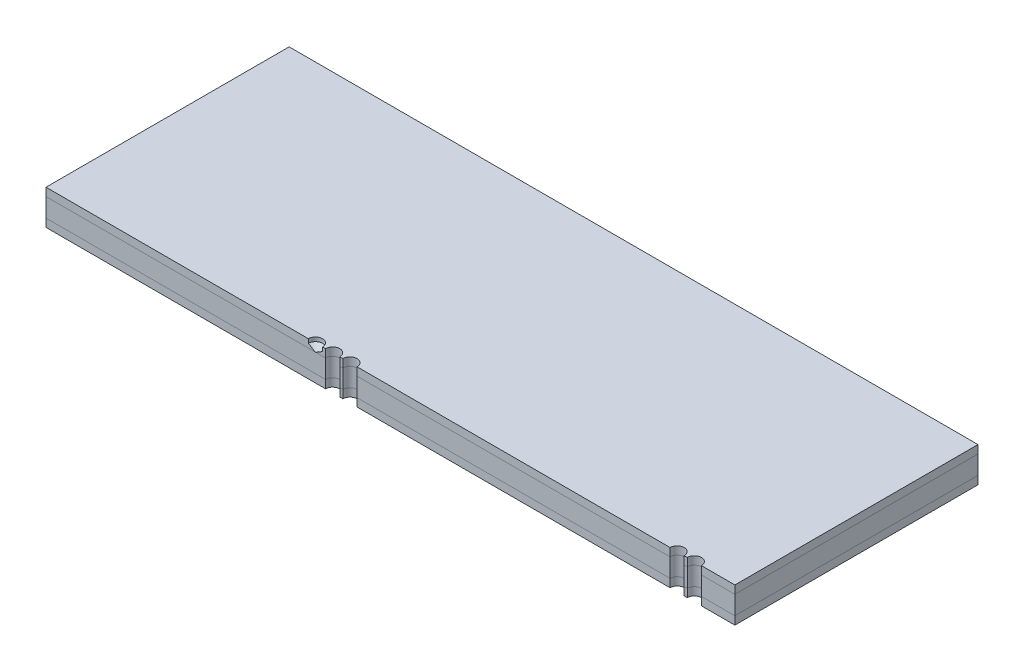
from build123d import *

# Parameters (mm, degrees)
SKETCH1_W           = 170
SKETCH1_H           = 60
BOSS_EXTRUDE1_DEPTH = 2
SKETCH2_W           = 170
SKETCH2_H           = 60
BOSS_EXTRUDE2_DEPTH = 4.6
SKETCH3_W           = 170
SKETCH3_H           = 60
BOSS_EXTRUDE3_DEPTH = 2
SKETCH4_R           = 1.75
CUT_EXTRUDE1_DEPTH  = 105.398084274


with BuildPart() as part:
    # Sketch1 → Boss-Extrude1 (new body)
    with BuildSketch(Plane(origin=(0, 0, 0), x_dir=(1, 0, 0), z_dir=(0, 1, 0))):
        with Locations((0, 30)):
            Rectangle(SKETCH1_W, SKETCH1_H)
    extrude(amount=BOSS_EXTRUDE1_DEPTH)


with BuildPart() as body_2:
    # Sketch2 → Boss-Extrude2 (new body)
    with BuildSketch(Plane.XZ):
        with Locations((0, -30)):
            Rectangle(SKETCH2_W, SKETCH2_H)
    extrude(amount=BOSS_EXTRUDE2_DEPTH)


with BuildPart() as body_3:
    # Sketch3 → Boss-Extrude3 (new body)
    with BuildSketch(Plane.XZ.offset(4.6)):
        with Locations((0, -30)):
            Rectangle(SKETCH3_W, SKETCH3_H)
    extrude(amount=BOSS_EXTRUDE3_DEPTH)


with BuildPart() as cut_extrude1_tool:
    # Sketch4 → Cut-Extrude1 (new, through all)
    with BuildSketch(Plane(origin=(0, 2, 0), x_dir=(1, 0, 0), z_dir=(0, 1, 0))):
        with Locations((75, 0)):
            Circle(SKETCH4_R)
        with Locations((-10, 0)):
            Circle(SKETCH4_R)
        with Locations((70.75, 0)):
            Circle(SKETCH4_R)
        with Locations((-14.25, 0)):
            Circle(SKETCH4_R)
    extrude(amount=-CUT_EXTRUDE1_DEPTH)


with BuildPart() as part_1:
    add(part.part)

    # Cut-Extrude1: cut by cut_extrude1_tool
    add(cut_extrude1_tool.part, mode=Mode.SUBTRACT)


with BuildPart() as body_2_1:
    add(body_2.part)

    # Cut-Extrude1: cut by cut_extrude1_tool
    add(cut_extrude1_tool.part, mode=Mode.SUBTRACT)


with BuildPart() as body_3_1:
    add(body_3.part)

    # Cut-Extrude1: cut by cut_extrude1_tool
    add(cut_extrude1_tool.part, mode=Mode.SUBTRACT)


with BuildPart() as f_3_5_3_5_diameter_hole1_tool:
    # Sketch8 → Ø3.5 (3.5) Diameter Hole1 (revolve)
    with BuildSketch(Plane(origin=(-18.5, 2, 0), x_dir=(0, 0, 1), z_dir=(1, 0, 0))):
        Polygon((0, 0), (0, 2.051506083), (1.75, 1), (1.75, 0), align=None)
    revolve(axis=Axis((-18.5, 8.35, 0), (0, -1, 0)))


with BuildPart() as part_2:
    add(part_1.part)

    # Ø3.5 (3.5) Diameter Hole1: cut by f_3_5_3_5_diameter_hole1_tool
    add(f_3_5_3_5_diameter_hole1_tool.part, mode=Mode.SUBTRACT)


with BuildPart() as body_2_2:
    add(body_2_1.part)

    # Ø3.5 (3.5) Diameter Hole1: cut by f_3_5_3_5_diameter_hole1_tool
    add(f_3_5_3_5_diameter_hole1_tool.part, mode=Mode.SUBTRACT)


solid = Compound([body_3_1.part, part_2.part, body_2_2.part])
